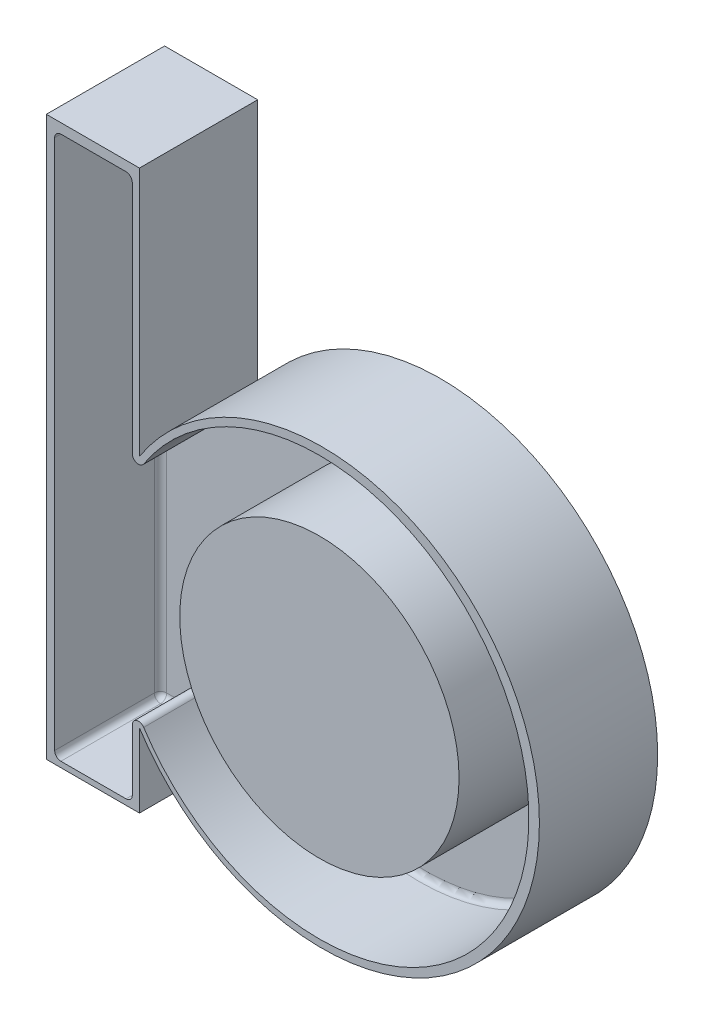
from build123d import *

# Parameters (mm, degrees)
BOSS_EXTRUDE1_DEPTH = 19.05
SKETCH4_R           = 22.5
CUT_EXTRUDE1_DEPTH  = 17.05
FILLET1_R           = 1


with BuildPart() as part:
    # Sketch1 → Boss-Extrude1 (new body)
    with BuildSketch(Plane.XY):
        with BuildLine():
            Line((14.641905013, 96.116783887), (29.641905013, 96.116783887))
            Line((29.641905013, 96.116783887), (29.641905013, 55.878392582))
            ThreePointArc((29.641905013, 55.878392582), (94.077954609, 36.943795037), (29.641905013, 18.009197492))
            Line((29.641905013, 18.009197492), (29.641905013, 6.116783887))
            Line((29.641905013, 6.116783887), (14.641905013, 6.116783887))
            Line((14.641905013, 6.116783887), (14.641905013, 96.116783887))
        make_face()
    extrude(amount=BOSS_EXTRUDE1_DEPTH)

    # Sketch4 → Cut-Extrude1 (cut)
    with BuildSketch(Plane.XY.offset(19.05)):
        with BuildLine():
            Line((28.486331549, 21.619208615), (28.486331549, 7.023321428))
            Line((28.486331549, 7.023321428), (15.986331549, 7.023321428))
            Line((15.986331549, 7.023321428), (15.986331549, 94.523321428))
            Line((15.986331549, 94.523321428), (28.486331549, 94.523321428))
            Line((28.486331549, 94.523321428), (28.486331549, 51.962640383))
            ThreePointArc((28.486331549, 51.962640383), (92.383993766, 36.790924499), (28.486331549, 21.619208615))
        make_face()
        with Locations((58.633993766, 36.790924499)):
            Circle(SKETCH4_R, mode=Mode.SUBTRACT)
    extrude(amount=-CUT_EXTRUDE1_DEPTH, mode=Mode.SUBTRACT)

    # Fillet1
    fillet1_edges = [part.edges().sort_by_distance(p)[0] for p in [
        (22.236331549, 7.023321428, 2),
        (28.486331549, 7.023321428, 10.525),
        (15.986331549, 50.773321428, 2),
        (15.986331549, 7.023321428, 10.525),
        (15.986331549, 94.523321428, 10.525),
        (28.486331549, 73.242980906, 2),
        (28.486331549, 94.523321428, 10.525),
        (92.383993766, 36.790924499, 2),
        (28.486331549, 51.962640383, 10.525),
        (28.486331549, 14.321265022, 2),
        (28.486331549, 21.619208615, 10.525),
    ]]
    fillet(fillet1_edges, radius=FILLET1_R)


solid = part.part
